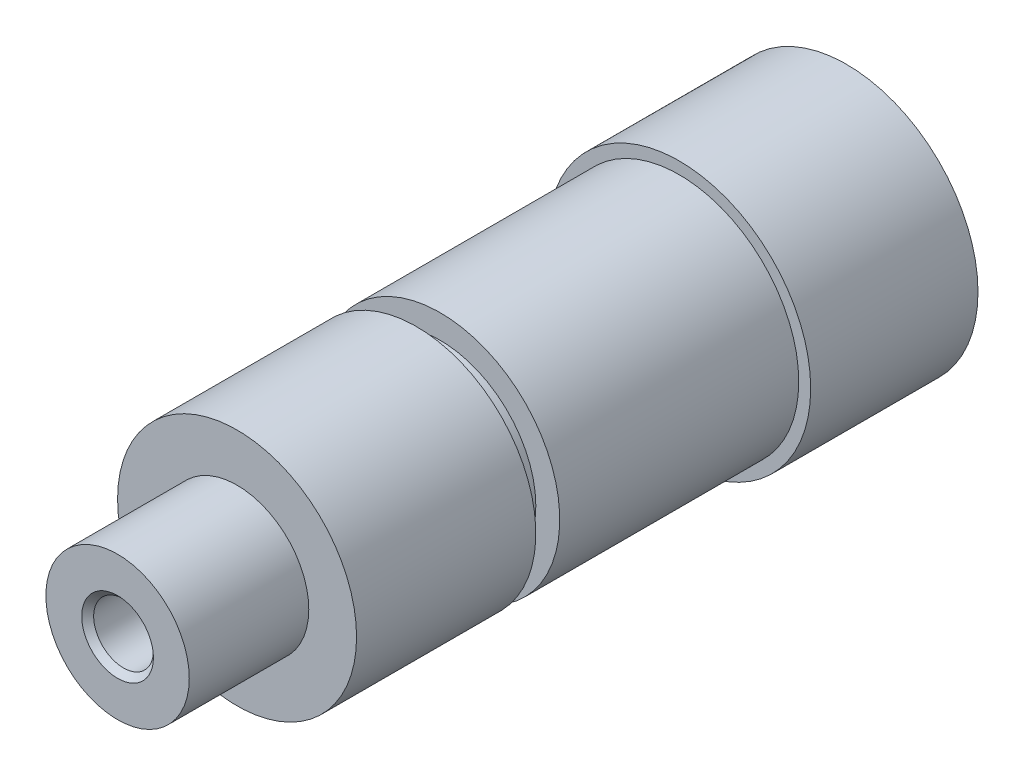
from build123d import *

# Parameters (mm, degrees)
ESQUISSE1_R                     = 11
BASE_EXTRUSION_DEPTH            = 14
ESQUISSE2_R                     = 10
BOSS_EXTRU_1_DEPTH              = 37
ESQUISSE3_W                     = 2
ESQUISSE3_H                     = 2
ESQUISSE4_R                     = 6
BOSS_EXTRU_2_DEPTH              = 10
TROU_TARAUD_M6X1_01_D           = 5
TROU_TARAUD_M6X1_01_DEPTH       = 19
TROU_TARAUD_M6X1_01_CSINK_D     = 6
TROU_TARAUD_M6X1_01_CSINK_ANGLE = 90
TROU_TARAUD_M6X1_01_TIP         = 1.502151548


with BuildPart() as part:
    # Esquisse1 → Base-Extrusion (new body)
    with BuildSketch(Plane.XY):
        Circle(ESQUISSE1_R)
    extrude(amount=BASE_EXTRUSION_DEPTH)

    # Esquisse2 → Boss.-Extru.1 (add)
    with BuildSketch(Plane.XY.offset(14)):
        with Locations(Location((0, 0, 0), (0, 0, 180))):
            Circle(ESQUISSE2_R)
    extrude(amount=BOSS_EXTRU_1_DEPTH)

    # Esquisse3 → Enlèvement de matière-Révolution1 (revolve, cut)
    with BuildSketch(Plane(origin=(0, 0, 0), x_dir=(1, 0, 0), z_dir=(0, 1, 0))):
        with Locations((9, -35)):
            Rectangle(ESQUISSE3_W, ESQUISSE3_H)
    revolve(axis=Axis((0, 0, 0), (0, 0, 1)), mode=Mode.SUBTRACT)

    # Esquisse4 → Boss.-Extru.2 (add)
    with BuildSketch(Plane.XY.offset(51)):
        Circle(ESQUISSE4_R)
    extrude(amount=BOSS_EXTRU_2_DEPTH)

    # Trou taraudé M6x1.01
    with Locations(Plane.XY.offset(61)):
        with Locations((0, 0)):
            CounterSinkHole(TROU_TARAUD_M6X1_01_D / 2, TROU_TARAUD_M6X1_01_CSINK_D / 2, depth=TROU_TARAUD_M6X1_01_DEPTH, counter_sink_angle=TROU_TARAUD_M6X1_01_CSINK_ANGLE)
            with Locations((0, 0, -(TROU_TARAUD_M6X1_01_DEPTH + TROU_TARAUD_M6X1_01_TIP / 2))):  # 118° drill point
                Cone(0, TROU_TARAUD_M6X1_01_D / 2, TROU_TARAUD_M6X1_01_TIP, mode=Mode.SUBTRACT)


solid = part.part
